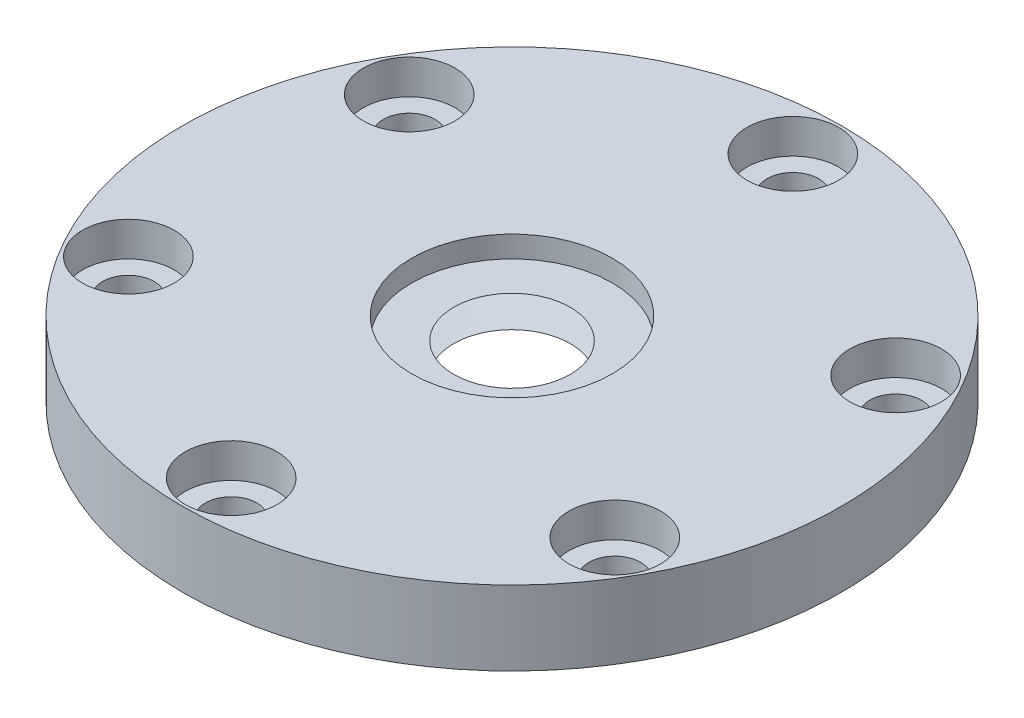
from build123d import *

# Parameters (mm, degrees)
SKETCH_1_R               = 57.5
EXTRUDE_1_DEPTH          = 6.5
SKETCH_3_R               = 8
CUT_EXTRUDE_1_DEPTH      = 6
SKETCH_4_R               = 4.5
CUT_EXTRUDE_2_DEPTH      = 82.618012718
PATTERN_CIRCULAR_1_COUNT = 6
SKETCH_6_R               = 17.5
CUT_EXTRUDE_3_DEPTH      = 3.75
SKETCH_9_R               = 17.5
CUT_EXTRUDE_4_DEPTH      = 3.75
SKETCH_10_R              = 40
SKETCH_10_R_2            = 34
EXTRUDE_2_DEPTH          = 5


with BuildPart() as part:
    # 草图1 → 凸台-拉伸1 (new, symmetric)
    with BuildSketch(Plane(origin=(0, 0, 0), x_dir=(1, 0, 0), z_dir=(0, 1, 0))):
        with Locations(Location((0, 0, 0), (0, 0, 90))):
            Circle(SKETCH_1_R)
    extrude(amount=EXTRUDE_1_DEPTH, both=True)

    # 草图3 → 切除-拉伸1 (cut)
    with BuildSketch(Plane(origin=(0, 6.5, 0), x_dir=(1, 0, 0), z_dir=(0, 1, 0))):
        with Locations(Location((0, 49, 0), (0, 0, 270))):
            Circle(SKETCH_3_R)
    cut_extrude_1 = extrude(amount=-CUT_EXTRUDE_1_DEPTH, mode=Mode.SUBTRACT)

    # 草图4 → 切除-拉伸2 (cut, through all)
    with BuildSketch(Plane(origin=(0, 0.5, 0), x_dir=(1, 0, 0), z_dir=(0, 1, 0))):
        with Locations(Location((0, 49, 0), (0, 0, 270))):
            Circle(SKETCH_4_R)
    cut_extrude_2 = extrude(amount=-CUT_EXTRUDE_2_DEPTH, mode=Mode.SUBTRACT)

    # 阵列(圆周)1: 切除-拉伸1, 切除-拉伸2 ×6 about axis
    pattern_circular_1_axis = Axis((0, 0, 0), (0, 1, 0))
    add([cut_extrude_1.rotate(pattern_circular_1_axis, i * 360 / PATTERN_CIRCULAR_1_COUNT) for i in range(1, PATTERN_CIRCULAR_1_COUNT)], mode=Mode.SUBTRACT)
    add([cut_extrude_2.rotate(pattern_circular_1_axis, i * 360 / PATTERN_CIRCULAR_1_COUNT) for i in range(1, PATTERN_CIRCULAR_1_COUNT)], mode=Mode.SUBTRACT)

    # 草图6 → 切除-拉伸3 (cut)
    with BuildSketch(Plane(origin=(0, 6.5, 0), x_dir=(1, 0, 0), z_dir=(0, 1, 0))):
        with Locations(Location((0, 0, 0), (0, 0, 270))):
            Circle(SKETCH_6_R)
    extrude(amount=-CUT_EXTRUDE_3_DEPTH, mode=Mode.SUBTRACT)

    # 草图8 → 切除-旋转1 (revolve, cut)
    with BuildSketch(Plane.XY, mode=Mode.PRIVATE) as cut_revolve_1_sk:
        Polygon((-10.158018271, 2.75), (-18.189384238, 2), (-18.189384238, -2), (-10.158018271, -2.75), (0, -2.75), (0, 2.75), align=None)
    revolve(cut_revolve_1_sk.sketch.rotate(Axis((0, 37.664252475, 0), (0, -1, 0)), 270), axis=Axis((0, 37.664252475, 0), (0, -1, 0)), mode=Mode.SUBTRACT)

    # 草图9 → 切除-拉伸4 (cut)
    with BuildSketch(Plane(origin=(0, -2.75, 0), x_dir=(1, 0, 0), z_dir=(0, 1, 0))):
        with Locations(Location((0, 0, 0), (0, 0, 270))):
            Circle(SKETCH_9_R)
    extrude(amount=-CUT_EXTRUDE_4_DEPTH, mode=Mode.SUBTRACT)

    # 草图10 → 凸台-拉伸2 (add)
    with BuildSketch(Plane.XZ.offset(6.5)):
        with Locations(Location((0, 0, 0), (0, 0, 90))):
            Circle(SKETCH_10_R)
        with Locations(Location((0, 0, 0), (0, 0, 270))):
            Circle(SKETCH_10_R_2, mode=Mode.SUBTRACT)
    extrude(amount=EXTRUDE_2_DEPTH)


solid = part.part
